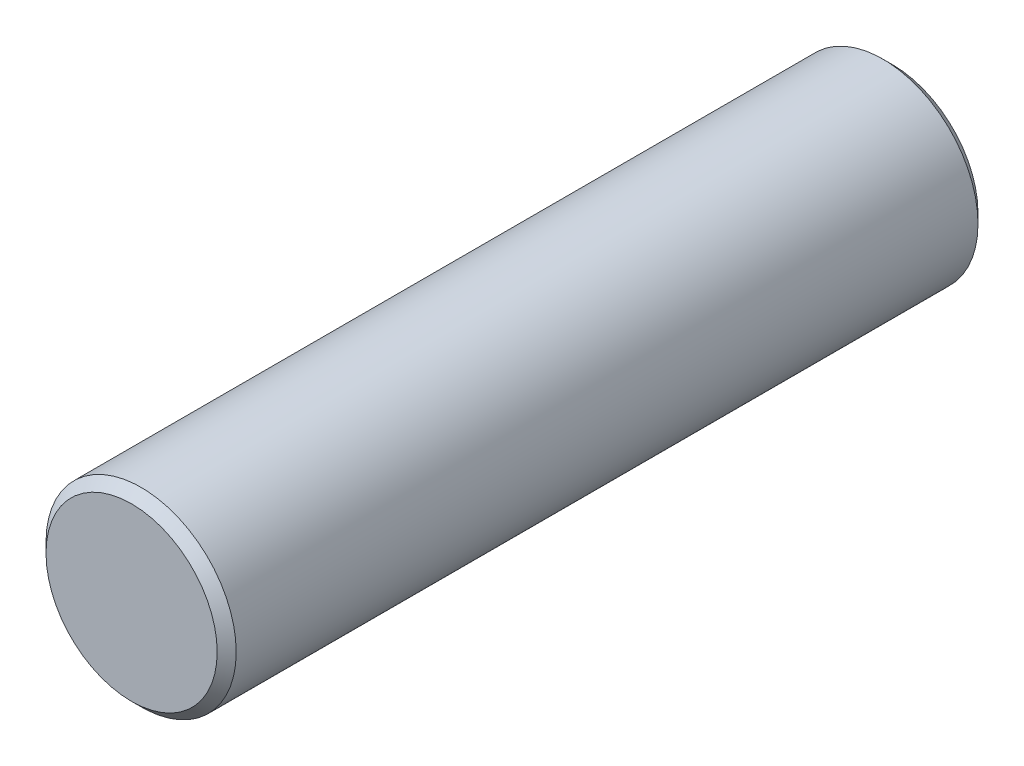
from build123d import *

# Parameters (mm, degrees)
SKETCH1_R           = 1
BOSS_EXTRUDE2_DEPTH = 4
CHAMFER1_SIZE       = 0.1


with BuildPart() as part:
    # Sketch1 → Boss-Extrude2 (new, symmetric)
    with BuildSketch(Plane.XY):
        Circle(SKETCH1_R)
    extrude(amount=BOSS_EXTRUDE2_DEPTH, both=True)

    # Chamfer1
    chamfer1_edges = [part.edges().sort_by_distance(p)[0] for p in [
        (-1, 0, -4),
        (-1, 0, 4),
    ]]
    chamfer(chamfer1_edges, length=CHAMFER1_SIZE)


solid = part.part
